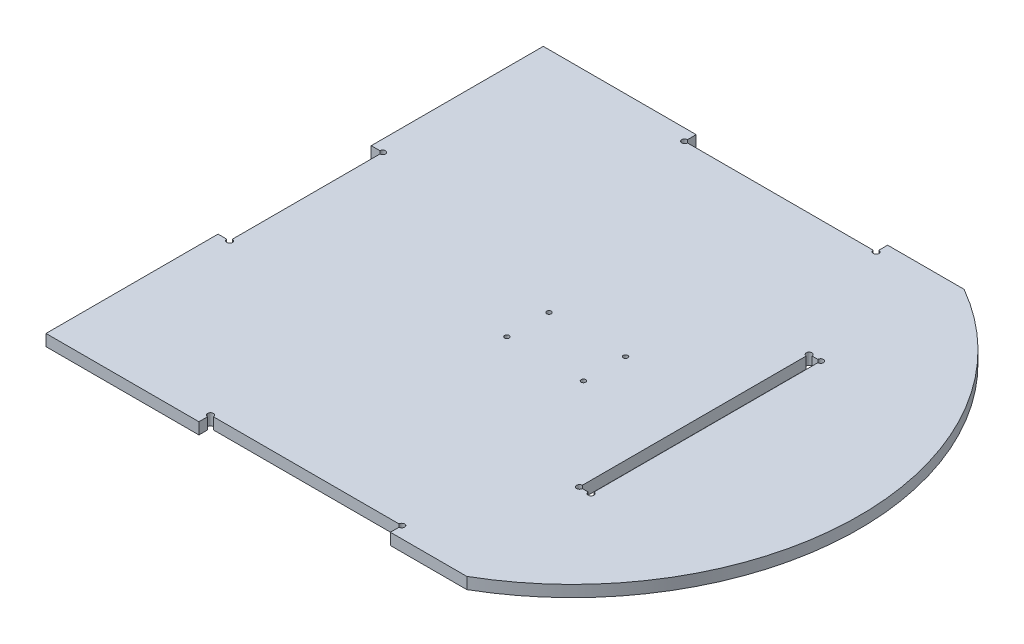
from build123d import *

# Parameters (mm, degrees)
BOSS_EXTRUDE1_DEPTH       = 6
M2_CLEARANCE_HOLE1_D      = 2.4
CUT_EXTRUDE1_REACH        = 212.276
SKETCH4_W                 = 6.1
SKETCH4_H                 = 120.1
SKETCH4_W_2               = 100.1
SKETCH4_H_2               = 6.1
SKETCH4_H_3               = 80.1
F_3_0MM_DOWEL_HOLE1_D     = 3
F_3_0MM_DOWEL_HOLE1_DEPTH = 6


with BuildPart() as part:
    # Sketch1 → Boss-Extrude1 (new body)
    with BuildSketch(Plane(origin=(0, 0, 0), x_dir=(1, 0, 0), z_dir=(0, 1, 0))):
        with BuildLine():
            Line((-130, 130), (90, 130))
            ThreePointArc((90, 130), (165.166852265, 0), (90, -130))
            Line((90, -130), (-130, -130))
            Line((-130, -130), (-130, 130))
        make_face()
    extrude(amount=-BOSS_EXTRUDE1_DEPTH)

    # M2 Clearance Hole1 (through all)
    with Locations(Plane(origin=(0, -6, 0), x_dir=(-1, 0, 0), z_dir=(0, -1, 0))):
        with Locations((-32, -11), (-32, 11), (8, -11), (8, 11)):
            Hole(M2_CLEARANCE_HOLE1_D / 2)

    # Sketch4 → Cut-Extrude1 (cut, up to next)
    with BuildSketch(Plane.XZ.offset(6), mode=Mode.PRIVATE) as cut_extrude1_sk1:
        with Locations((82, 0)):
            Rectangle(SKETCH4_W, SKETCH4_H)
    cut_extrude1_tool1 = extrude(cut_extrude1_sk1.sketch, amount=-CUT_EXTRUDE1_REACH, mode=Mode.PRIVATE) & part.part
    # Sketch4 → Cut-Extrude1 (cut, up to next)
    with BuildSketch(Plane.XZ.offset(6), mode=Mode.PRIVATE) as cut_extrude1_sk2:
        with Locations((0, -127)):
            Rectangle(SKETCH4_W_2, SKETCH4_H_2)
    cut_extrude1_tool2 = extrude(cut_extrude1_sk2.sketch, amount=-CUT_EXTRUDE1_REACH, mode=Mode.PRIVATE) & part.part
    # Sketch4 → Cut-Extrude1 (cut, up to next)
    with BuildSketch(Plane.XZ.offset(6), mode=Mode.PRIVATE) as cut_extrude1_sk3:
        with Locations((0, 127)):
            Rectangle(SKETCH4_W_2, SKETCH4_H_2)
    cut_extrude1_tool3 = extrude(cut_extrude1_sk3.sketch, amount=-CUT_EXTRUDE1_REACH, mode=Mode.PRIVATE) & part.part
    # Sketch4 → Cut-Extrude1 (cut, up to next)
    with BuildSketch(Plane.XZ.offset(6), mode=Mode.PRIVATE) as cut_extrude1_sk4:
        with Locations((-127, 0)):
            Rectangle(SKETCH4_W, SKETCH4_H_3)
    cut_extrude1_tool4 = extrude(cut_extrude1_sk4.sketch, amount=-CUT_EXTRUDE1_REACH, mode=Mode.PRIVATE) & part.part
    add(cut_extrude1_tool1.solids().sort_by_distance((82, -6, 0))[0], mode=Mode.SUBTRACT)
    add(cut_extrude1_tool2.solids().sort_by_distance((0, -6, -127))[0], mode=Mode.SUBTRACT)
    add(cut_extrude1_tool3.solids().sort_by_distance((0, -6, 127))[0], mode=Mode.SUBTRACT)
    add(cut_extrude1_tool4.solids().sort_by_distance((-127, -6, 0))[0], mode=Mode.SUBTRACT)

    # Ø3.0mm Dowel Hole1
    with Locations(Plane(origin=(0, -6, 0), x_dir=(-1, 0, 0), z_dir=(0, -1, 0))):
        with Locations((-85, 60), (-79, 60), (-78.95, -60.05), (-85, -60), (124, 40), (123.95, -40.05), (50.05, -123.95), (-50, -124), (-50.05, 123.95), (50.05, 123.95)):
            Hole(F_3_0MM_DOWEL_HOLE1_D / 2, depth=F_3_0MM_DOWEL_HOLE1_DEPTH)


solid = part.part
